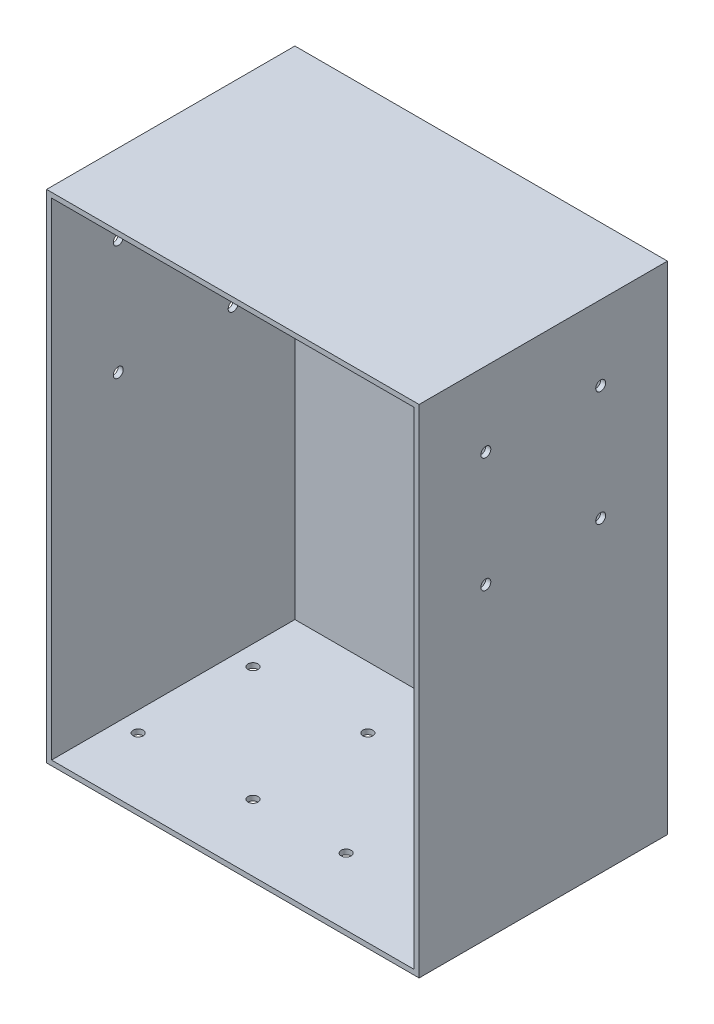
from build123d import *

# Parameters (mm, degrees)
IZIM1_W                     = 300
IZIM1_H                     = 400
Y_KSEKLIK_EKSTR_ZYON1_DEPTH = 200
BO_ALTMA1_T                 = -4
KES_EKSTR_ZYON1_REACH       = 540.516
IZIM2_R                     = 4
KES_EKSTR_ZYON2_REACH       = 540.516
IZIM4_R                     = 4


with BuildPart() as part:
    # Çizim1 → Yükseklik-Ekstrüzyon1 (new body)
    with BuildSketch(Plane.XY):
        with Locations((-150, 200)):
            Rectangle(IZIM1_W, IZIM1_H)
    extrude(amount=Y_KSEKLIK_EKSTR_ZYON1_DEPTH)

    # İç Boşaltma1
    bo_altma1_openings = [part.faces().sort_by_distance(p)[0] for p in [
        (-150, 200, 200),
    ]]
    offset(amount=BO_ALTMA1_T, openings=bo_altma1_openings, kind=Kind.INTERSECTION)

    # Çizim2 → Kes-Ekstrüzyon1 (cut, up to next)
    with BuildSketch(Plane(origin=(0, 0, 0), x_dir=(0, 0, -1), z_dir=(1, 0, 0)), mode=Mode.PRIVATE) as kes_ekstr_zyon1_sk1:
        with Locations(Location((-146.25, 340, 0), (0, 0, 90))):
            Circle(IZIM2_R)
    kes_ekstr_zyon1_tool1 = extrude(kes_ekstr_zyon1_sk1.sketch, amount=-KES_EKSTR_ZYON1_REACH, mode=Mode.PRIVATE) & part.part
    # Çizim2 → Kes-Ekstrüzyon1 (cut, up to next)
    with BuildSketch(Plane(origin=(0, 0, 0), x_dir=(0, 0, -1), z_dir=(1, 0, 0)), mode=Mode.PRIVATE) as kes_ekstr_zyon1_sk2:
        with Locations(Location((-53.75, 340, 0), (0, 0, 90))):
            Circle(IZIM2_R)
    kes_ekstr_zyon1_tool2 = extrude(kes_ekstr_zyon1_sk2.sketch, amount=-KES_EKSTR_ZYON1_REACH, mode=Mode.PRIVATE) & part.part
    # Çizim2 → Kes-Ekstrüzyon1 (cut, up to next)
    with BuildSketch(Plane(origin=(0, 0, 0), x_dir=(0, 0, -1), z_dir=(1, 0, 0)), mode=Mode.PRIVATE) as kes_ekstr_zyon1_sk3:
        with Locations(Location((-146.25, 247.5, 0), (0, 0, 90))):
            Circle(IZIM2_R)
    kes_ekstr_zyon1_tool3 = extrude(kes_ekstr_zyon1_sk3.sketch, amount=-KES_EKSTR_ZYON1_REACH, mode=Mode.PRIVATE) & part.part
    # Çizim2 → Kes-Ekstrüzyon1 (cut, up to next)
    with BuildSketch(Plane(origin=(0, 0, 0), x_dir=(0, 0, -1), z_dir=(1, 0, 0)), mode=Mode.PRIVATE) as kes_ekstr_zyon1_sk4:
        with Locations(Location((-53.75, 247.5, 0), (0, 0, 90))):
            Circle(IZIM2_R)
    kes_ekstr_zyon1_tool4 = extrude(kes_ekstr_zyon1_sk4.sketch, amount=-KES_EKSTR_ZYON1_REACH, mode=Mode.PRIVATE) & part.part
    kes_ekstr_zyon1_1 = kes_ekstr_zyon1_tool1.solids().sort_by_distance((0, 340, 146.25))[0]
    add(kes_ekstr_zyon1_1, mode=Mode.SUBTRACT)
    kes_ekstr_zyon1_2 = kes_ekstr_zyon1_tool2.solids().sort_by_distance((0, 340, 53.75))[0]
    add(kes_ekstr_zyon1_2, mode=Mode.SUBTRACT)
    kes_ekstr_zyon1_3 = kes_ekstr_zyon1_tool3.solids().sort_by_distance((0, 247.5, 146.25))[0]
    add(kes_ekstr_zyon1_3, mode=Mode.SUBTRACT)
    kes_ekstr_zyon1_4 = kes_ekstr_zyon1_tool4.solids().sort_by_distance((0, 247.5, 53.75))[0]
    add(kes_ekstr_zyon1_4, mode=Mode.SUBTRACT)
    kes_ekstr_zyon1 = kes_ekstr_zyon1_1 + kes_ekstr_zyon1_2 + kes_ekstr_zyon1_3 + kes_ekstr_zyon1_4  # Kes-Ekstrüzyon1 as one shape, for the pattern or mirror that repeats it

    # Aynalama1: Kes-Ekstrüzyon1 across plane
    add(kes_ekstr_zyon1.mirror(Plane(origin=(-150, 0, 0), x_dir=(0, 0, 1), z_dir=(1, 0, 0))), mode=Mode.SUBTRACT)

    # Çizim4 → Kes-Ekstrüzyon2 (cut, up to next)
    with BuildSketch(Plane.XZ, mode=Mode.PRIVATE) as kes_ekstr_zyon2_sk1:
        with Locations(Location((-280, 146.25, 0), (0, 0, 270))):
            Circle(IZIM4_R)
    kes_ekstr_zyon2_tool1 = extrude(kes_ekstr_zyon2_sk1.sketch, amount=-KES_EKSTR_ZYON2_REACH, mode=Mode.PRIVATE) & part.part
    # Çizim4 → Kes-Ekstrüzyon2 (cut, up to next)
    with BuildSketch(Plane.XZ, mode=Mode.PRIVATE) as kes_ekstr_zyon2_sk2:
        with Locations(Location((-280, 53.75, 0), (0, 0, 270))):
            Circle(IZIM4_R)
    kes_ekstr_zyon2_tool2 = extrude(kes_ekstr_zyon2_sk2.sketch, amount=-KES_EKSTR_ZYON2_REACH, mode=Mode.PRIVATE) & part.part
    # Çizim4 → Kes-Ekstrüzyon2 (cut, up to next)
    with BuildSketch(Plane.XZ, mode=Mode.PRIVATE) as kes_ekstr_zyon2_sk3:
        with Locations(Location((-187.5, 146.25, 0), (0, 0, 270))):
            Circle(IZIM4_R)
    kes_ekstr_zyon2_tool3 = extrude(kes_ekstr_zyon2_sk3.sketch, amount=-KES_EKSTR_ZYON2_REACH, mode=Mode.PRIVATE) & part.part
    # Çizim4 → Kes-Ekstrüzyon2 (cut, up to next)
    with BuildSketch(Plane.XZ, mode=Mode.PRIVATE) as kes_ekstr_zyon2_sk4:
        with Locations(Location((-187.5, 53.75, 0), (0, 0, 270))):
            Circle(IZIM4_R)
    kes_ekstr_zyon2_tool4 = extrude(kes_ekstr_zyon2_sk4.sketch, amount=-KES_EKSTR_ZYON2_REACH, mode=Mode.PRIVATE) & part.part
    # Çizim4 → Kes-Ekstrüzyon2 (cut, up to next)
    with BuildSketch(Plane.XZ, mode=Mode.PRIVATE) as kes_ekstr_zyon2_sk5:
        with Locations(Location((-20, 146.25, 0), (0, 0, 90))):
            Circle(IZIM4_R)
    kes_ekstr_zyon2_tool5 = extrude(kes_ekstr_zyon2_sk5.sketch, amount=-KES_EKSTR_ZYON2_REACH, mode=Mode.PRIVATE) & part.part
    # Çizim4 → Kes-Ekstrüzyon2 (cut, up to next)
    with BuildSketch(Plane.XZ, mode=Mode.PRIVATE) as kes_ekstr_zyon2_sk6:
        with Locations(Location((-20, 53.75, 0), (0, 0, 90))):
            Circle(IZIM4_R)
    kes_ekstr_zyon2_tool6 = extrude(kes_ekstr_zyon2_sk6.sketch, amount=-KES_EKSTR_ZYON2_REACH, mode=Mode.PRIVATE) & part.part
    # Çizim4 → Kes-Ekstrüzyon2 (cut, up to next)
    with BuildSketch(Plane.XZ, mode=Mode.PRIVATE) as kes_ekstr_zyon2_sk7:
        with Locations(Location((-112.5, 53.75, 0), (0, 0, 90))):
            Circle(IZIM4_R)
    kes_ekstr_zyon2_tool7 = extrude(kes_ekstr_zyon2_sk7.sketch, amount=-KES_EKSTR_ZYON2_REACH, mode=Mode.PRIVATE) & part.part
    # Çizim4 → Kes-Ekstrüzyon2 (cut, up to next)
    with BuildSketch(Plane.XZ, mode=Mode.PRIVATE) as kes_ekstr_zyon2_sk8:
        with Locations(Location((-112.5, 146.25, 0), (0, 0, 90))):
            Circle(IZIM4_R)
    kes_ekstr_zyon2_tool8 = extrude(kes_ekstr_zyon2_sk8.sketch, amount=-KES_EKSTR_ZYON2_REACH, mode=Mode.PRIVATE) & part.part
    add(kes_ekstr_zyon2_tool1.solids().sort_by_distance((-280, 0, 146.25))[0], mode=Mode.SUBTRACT)
    add(kes_ekstr_zyon2_tool2.solids().sort_by_distance((-280, 0, 53.75))[0], mode=Mode.SUBTRACT)
    add(kes_ekstr_zyon2_tool3.solids().sort_by_distance((-187.5, 0, 146.25))[0], mode=Mode.SUBTRACT)
    add(kes_ekstr_zyon2_tool4.solids().sort_by_distance((-187.5, 0, 53.75))[0], mode=Mode.SUBTRACT)
    add(kes_ekstr_zyon2_tool5.solids().sort_by_distance((-20, 0, 146.25))[0], mode=Mode.SUBTRACT)
    add(kes_ekstr_zyon2_tool6.solids().sort_by_distance((-20, 0, 53.75))[0], mode=Mode.SUBTRACT)
    add(kes_ekstr_zyon2_tool7.solids().sort_by_distance((-112.5, 0, 53.75))[0], mode=Mode.SUBTRACT)
    add(kes_ekstr_zyon2_tool8.solids().sort_by_distance((-112.5, 0, 146.25))[0], mode=Mode.SUBTRACT)


solid = part.part
